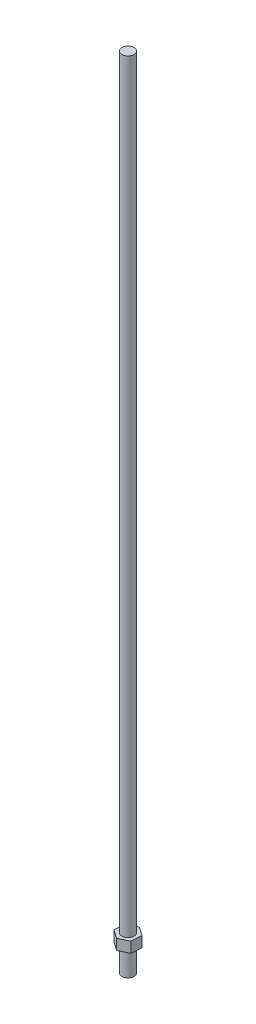
from build123d import *

# Parameters (mm, degrees)
SKETCH1_R           = 6.35
BOSS_EXTRUDE1_DEPTH = 831.85
BOSS_EXTRUDE2_START = 25.4
BOSS_EXTRUDE2_DEPTH = 11.049


with BuildPart() as part:
    # Sketch1 → Boss-Extrude1 (new body)
    with BuildSketch(Plane(origin=(0, 0, 0), x_dir=(1, 0, 0), z_dir=(0, 1, 0))):
        with Locations(Location((0, 0, 0), (0, 0, 90))):
            Circle(SKETCH1_R)
    extrude(amount=BOSS_EXTRUDE1_DEPTH)

    # Sketch3 → Boss-Extrude2 (add)
    with BuildSketch(Plane(origin=(0, 0, 0), x_dir=(1, 0, 0), z_dir=(0, 1, 0)).offset(BOSS_EXTRUDE2_START)):
        Polygon((9.876865428, 4.838907863), (0.747815578, 10.973070302), (-9.129049851, 6.134162439), (-9.876865428, -4.838907863), (-0.747815578, -10.973070302), (9.129049851, -6.134162439), align=None)
    extrude(amount=BOSS_EXTRUDE2_DEPTH)


solid = part.part
